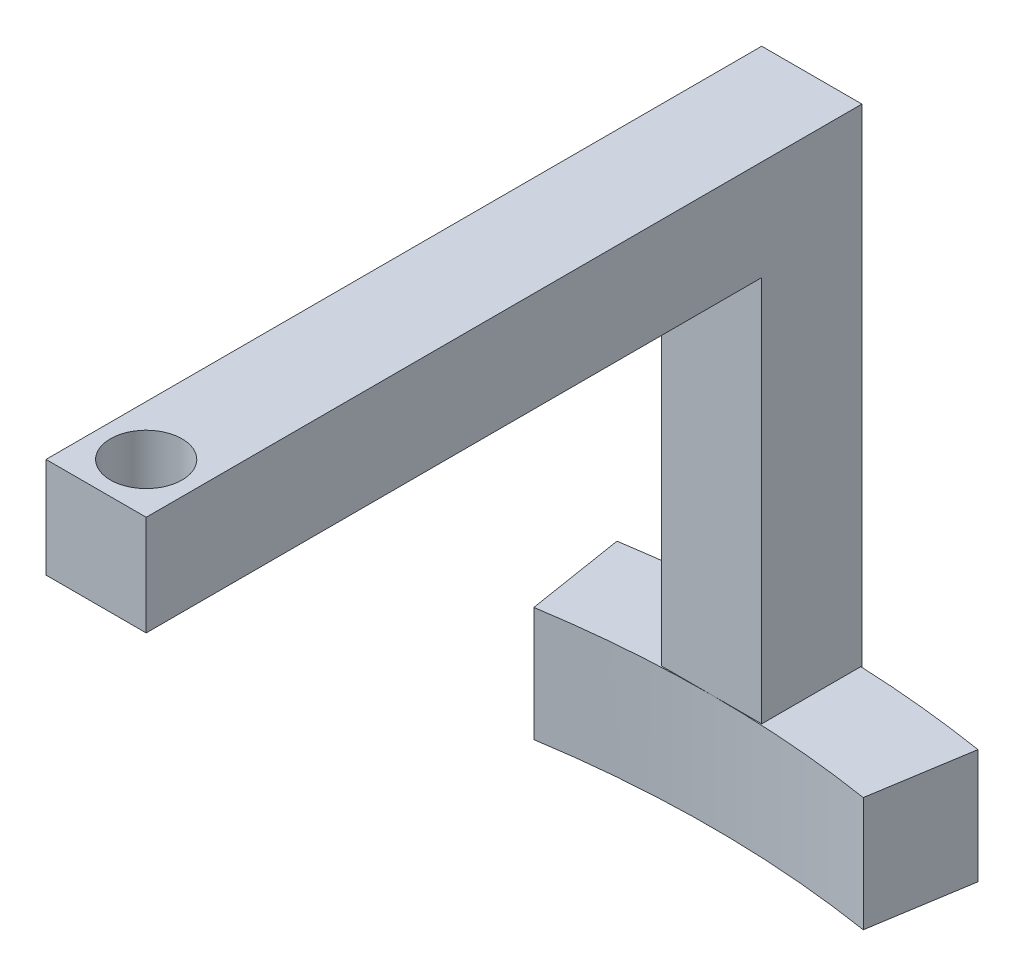
from build123d import *

# Parameters (mm, degrees)
BOSS_EXTRUDE1_DEPTH = 3.5
BOSS_EXTRUDE3_DEPTH = 4
SKETCH4_R           = 1.25
CUT_EXTRUDE1_DEPTH  = 4


with BuildPart() as part:
    # Sketch1 → Boss-Extrude1 (new body)
    with BuildSketch(Plane(origin=(0, 0, 0), x_dir=(0, 0, -1), z_dir=(1, 0, 0))):
        Polygon((0, 30.375), (25, 30.375), (25, 9.375), (21.5, 9.375), (21.5, 26.875), (0, 26.875), align=None)
    extrude(amount=BOSS_EXTRUDE1_DEPTH)

    # Sketch3 → Boss-Extrude3 (add)
    with BuildSketch(Plane(origin=(0, 9.375, 0), x_dir=(-1, 0, 0), z_dir=(0, -1, 0))):
        with BuildLine():
            Line((4.554760106, 24.5), (4.003093597, 21.04375))
            ThreePointArc((4.003093597, 21.04375), (-1.75, 21.5), (-7.503093597, 21.04375))
            Line((-7.503093597, 21.04375), (-8.054760106, 24.5))
            ThreePointArc((-8.054760106, 24.5), (-1.75, 25), (4.554760106, 24.5))
        make_face()
    extrude(amount=-BOSS_EXTRUDE3_DEPTH)

    # Sketch4 → Cut-Extrude1 (cut)
    with BuildSketch(Plane(origin=(0, 30.375, 0), x_dir=(1, 0, 0), z_dir=(0, 1, 0))):
        with Locations(Location((1.75, 1.75, 0), (0, 0, 270))):
            Circle(SKETCH4_R)
    extrude(amount=-CUT_EXTRUDE1_DEPTH, mode=Mode.SUBTRACT)


solid = part.part
